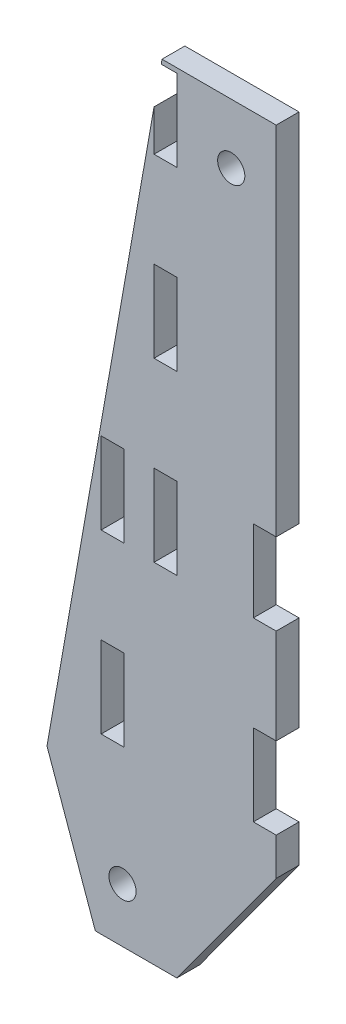
from build123d import *

# Parameters (mm, degrees)
BODYSHAPE_DEPTH      = 5.334
SKETCH2_W            = 5.334
SKETCH2_H            = 19.05
MOTORMOUNTCUTS_DEPTH = 151.780754949
SKETCH3_R            = 3.175
BOLTHOLES_DEPTH      = 151.780754949
SKETCH4_W            = 5.334
SKETCH4_H            = 19.05
CUT_EXTRUDE3_DEPTH   = 151.780754949


with BuildPart() as part:
    # Sketch1 → BodyShape (new body)
    with BuildSketch(Plane.XY):
        Polygon((-80.812244673, 105.406062542), (-54.142244673, 105.406062542), (-54.142244673, -46.993937458), (-77.342244755, -78.743937458), (-96.392244755, -78.743937458), (-107.684476533, -46.993937458), align=None)
    extrude(amount=BODYSHAPE_DEPTH)

    # Sketch2 → MotorMountCuts (cut, through all)
    with BuildSketch(Plane.XY.offset(5.334)):
        with Locations((-56.809244673, -28.705937458)):
            Rectangle(SKETCH2_W, SKETCH2_H)
        with Locations((-56.809244673, 12.569062542)):
            Rectangle(SKETCH2_W, SKETCH2_H)
        with Locations((-92.369244673, -28.705937458)):
            Rectangle(SKETCH2_W, SKETCH2_H)
        with Locations((-92.369244673, 12.569062542)):
            Rectangle(SKETCH2_W, SKETCH2_H)
    extrude(amount=-MOTORMOUNTCUTS_DEPTH, mode=Mode.SUBTRACT)

    # Sketch3 → BoltHoles (cut, through all)
    with BuildSketch(Plane.XY.offset(5.334)):
        with Locations((-90.042244755, -66.043937458)):
            Circle(SKETCH3_R)
        with Locations((-64.642244755, 91.436062542)):
            Circle(SKETCH3_R)
    extrude(amount=-BOLTHOLES_DEPTH, mode=Mode.SUBTRACT)

    # Sketch4 → Cut-Extrude3 (cut, through all)
    with BuildSketch(Plane.XY.offset(5.334)):
        with Locations((-80.009244755, 94.771037838)):
            Rectangle(SKETCH4_W, SKETCH4_H)
        with Locations((-80.009244755, 53.496037838)):
            Rectangle(SKETCH4_W, SKETCH4_H)
        with Locations((-80.009244755, 12.221037838)):
            Rectangle(SKETCH4_W, SKETCH4_H)
    extrude(amount=-CUT_EXTRUDE3_DEPTH, mode=Mode.SUBTRACT)


solid = part.part
